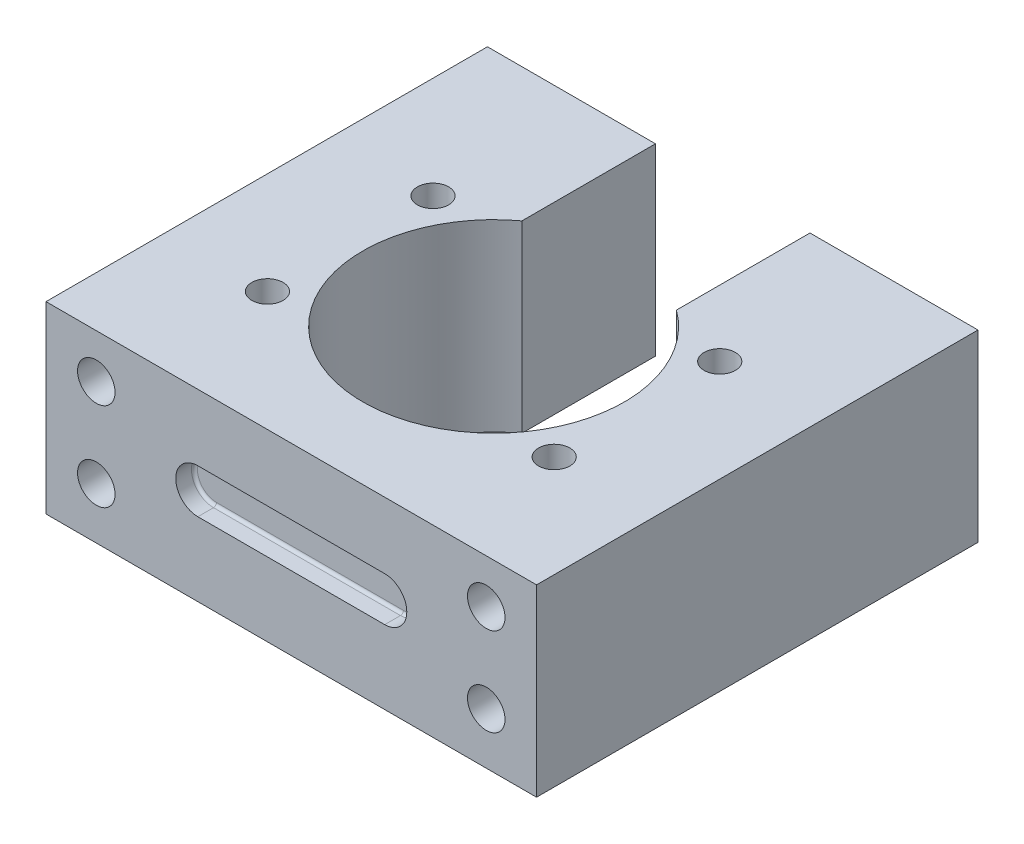
from build123d import *

# Parameters (mm, degrees)
SKETCH1_W               = 133.35
SKETCH1_H               = 120.65
BOSS_EXTRUDE1_DEPTH     = 28.575
CUT_EXTRUDE2_DEPTH      = 141.221561288
CUT_EXTRUDE2_DEPTH_BACK = 141.221561288
SKETCH1_3_W             = 133.35
SKETCH1_3_H             = 0.65
SKETCH2_W               = 120
SKETCH2_H               = 7.15
CUT_EXTRUDE3_DEPTH      = 182.655589303
SKETCH3_R               = 35.56
CUT_EXTRUDE4_DEPTH      = 147.101182832
SKETCH4_W               = 42
SKETCH4_H               = 36.303073335
CUT_EXTRUDE5_DEPTH      = 147.101182832
M10_TAPPED_HOLE1_D      = 8.5
M10_TAPPED_HOLE1_DEPTH  = 27.5
M10_TAPPED_HOLE1_TIP    = 2.553657631
M12_TAPPED_HOLE1_D      = 10.2
M12_TAPPED_HOLE1_DEPTH  = 43.99
M12_TAPPED_HOLE1_TIP    = 3.064389157
CUT_EXTRUDE6_DEPTH      = 5.08
FILLET1_R               = 0.8128


with BuildPart() as part:
    # Sketch1 → Boss-Extrude1 (new, symmetric)
    with BuildSketch(Plane(origin=(0, 0, 0), x_dir=(1, 0, 0), z_dir=(0, 1, 0))):
        with Locations((0, 59.675)):
            Rectangle(SKETCH1_W, SKETCH1_H)
    extrude(amount=BOSS_EXTRUDE1_DEPTH, both=True)

    # Sketch1<3> → Cut-Extrude2 (cut, two sides: drawn at the far end of the back side and taken through both)
    with BuildSketch(Plane(origin=(0, 0, 0), x_dir=(1, 0, 0), z_dir=(0, 1, 0)).offset(-CUT_EXTRUDE2_DEPTH_BACK)):
        with Locations((0, -0.325)):
            Rectangle(SKETCH1_3_W, SKETCH1_3_H)
    extrude(amount=CUT_EXTRUDE2_DEPTH + CUT_EXTRUDE2_DEPTH_BACK, mode=Mode.SUBTRACT)

    # Sketch2 → Cut-Extrude3 (cut, through all)
    with BuildSketch(Plane(origin=(66.675, 0, 0), x_dir=(0, 0, -1), z_dir=(1, 0, 0))):
        with Locations((60, 25)):
            Rectangle(SKETCH2_W, SKETCH2_H)
    extrude(amount=-CUT_EXTRUDE3_DEPTH, mode=Mode.SUBTRACT)

    # Sketch3 → Cut-Extrude4 (cut, through all)
    with BuildSketch(Plane(origin=(0, 21.425, 0), x_dir=(1, 0, 0), z_dir=(0, 1, 0))):
        with Locations((0, 55)):
            Circle(SKETCH3_R)
    extrude(amount=-CUT_EXTRUDE4_DEPTH, mode=Mode.SUBTRACT)

    # Sketch4 → Cut-Extrude5 (cut, through all)
    with BuildSketch(Plane(origin=(0, 21.425, 0), x_dir=(1, 0, 0), z_dir=(0, 1, 0))):
        with Locations((0, 101.848463333)):
            Rectangle(SKETCH4_W, SKETCH4_H)
    extrude(amount=-CUT_EXTRUDE5_DEPTH, mode=Mode.SUBTRACT)

    # M10 Tapped Hole1
    with Locations(Plane(origin=(0, 21.425, 0), x_dir=(1, 0, 0), z_dir=(0, 1, 0))):
        with Locations((-38.97114317, 77.5), (-38.97114317, 32.5), (38.97114317, 77.5), (38.97114317, 32.5)):
            Hole(M10_TAPPED_HOLE1_D / 2, depth=M10_TAPPED_HOLE1_DEPTH)
            with Locations((0, 0, -(M10_TAPPED_HOLE1_DEPTH + M10_TAPPED_HOLE1_TIP / 2))):  # 118° drill point
                Cone(0, M10_TAPPED_HOLE1_D / 2, M10_TAPPED_HOLE1_TIP, mode=Mode.SUBTRACT)

    # M12 Tapped Hole1
    with Locations(Plane.XY):
        with Locations((-53, 9.425), (-53, -14.575), (53, 9.425), (53, -14.575)):
            Hole(M12_TAPPED_HOLE1_D / 2, depth=M12_TAPPED_HOLE1_DEPTH)
            with Locations((0, 0, -(M12_TAPPED_HOLE1_DEPTH + M12_TAPPED_HOLE1_TIP / 2))):  # 118° drill point
                Cone(0, M12_TAPPED_HOLE1_D / 2, M12_TAPPED_HOLE1_TIP, mode=Mode.SUBTRACT)

    # Sketch9 → Cut-Extrude6 (cut)
    with BuildSketch(Plane.XY):
        with BuildLine():
            Line((-25.4, 3.425), (25.4, 3.425))
            ThreePointArc((25.4, 3.425), (31.4, -2.575), (25.4, -8.575))
            Line((25.4, -8.575), (-25.4, -8.575))
            ThreePointArc((-25.4, -8.575), (-31.4, -2.575), (-25.4, 3.425))
        make_face()
    extrude(amount=-CUT_EXTRUDE6_DEPTH, mode=Mode.SUBTRACT)

    # Fillet1
    fillet1_edges = [part.edges().sort_by_distance(p)[0] for p in [
        (0, -8.575, -5.08),
        (-31.4, -2.575, -5.08),
        (0, 3.425, -5.08),
        (31.4, -2.575, -5.08),
    ]]
    fillet(fillet1_edges, radius=FILLET1_R)


solid = part.part
